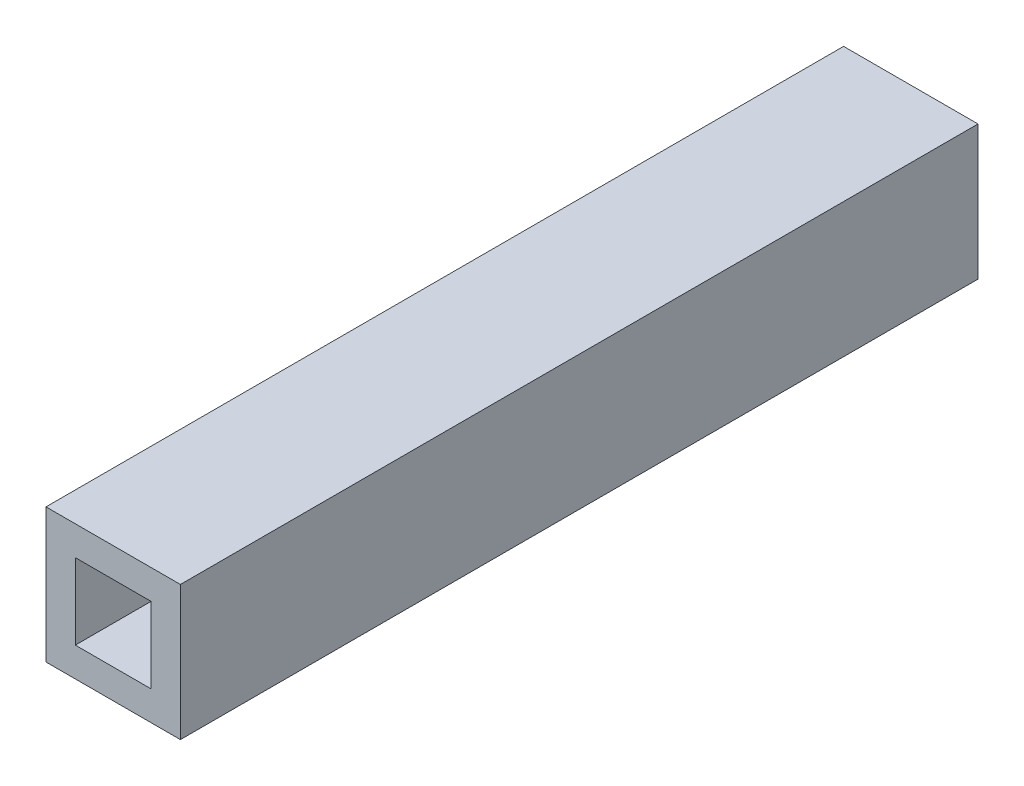
from build123d import *

# Parameters (mm, degrees)
SKETCH1_W           = 16.85
SKETCH1_H           = 16.85
SKETCH1_W_2         = 9.5
SKETCH1_H_2         = 9.5
BOSS_EXTRUDE1_DEPTH = 100


with BuildPart() as part:
    # Sketch1 → Boss-Extrude1 (new body)
    with BuildSketch(Plane.XY):
        with Locations((16.160752053, -0.994216696)):
            Rectangle(SKETCH1_W, SKETCH1_H)
        with Locations((16.160752053, -0.994216696)):
            Rectangle(SKETCH1_W_2, SKETCH1_H_2, mode=Mode.SUBTRACT)
    extrude(amount=-BOSS_EXTRUDE1_DEPTH)


solid = part.part
